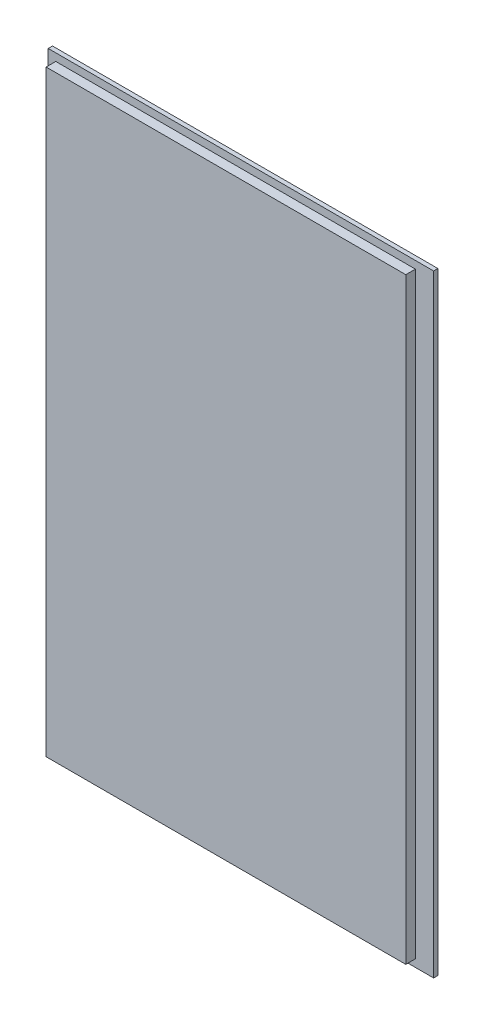
from build123d import *

# Parameters (mm, degrees)
SKICA1_W                = 72
SKICA1_H                = 114.4
P_IDAT_VYSUNUT_M1_DEPTH = 0.8
SKICA2_W                = 67.2
SKICA2_H                = 111.6
P_IDAT_VYSUNUT_M2_DEPTH = 1.8


with BuildPart() as part:
    # Skica1 → Přidat vysunutím1 (new body)
    with BuildSketch(Plane.XY):
        with Locations((36, 57.2)):
            Rectangle(SKICA1_W, SKICA1_H)
    extrude(amount=P_IDAT_VYSUNUT_M1_DEPTH)

    # Skica2 → Přidat vysunutím2 (add)
    with BuildSketch(Plane.XY.offset(0.8)):
        with Locations((35, 57.2)):
            Rectangle(SKICA2_W, SKICA2_H)
    extrude(amount=P_IDAT_VYSUNUT_M2_DEPTH)


solid = part.part
